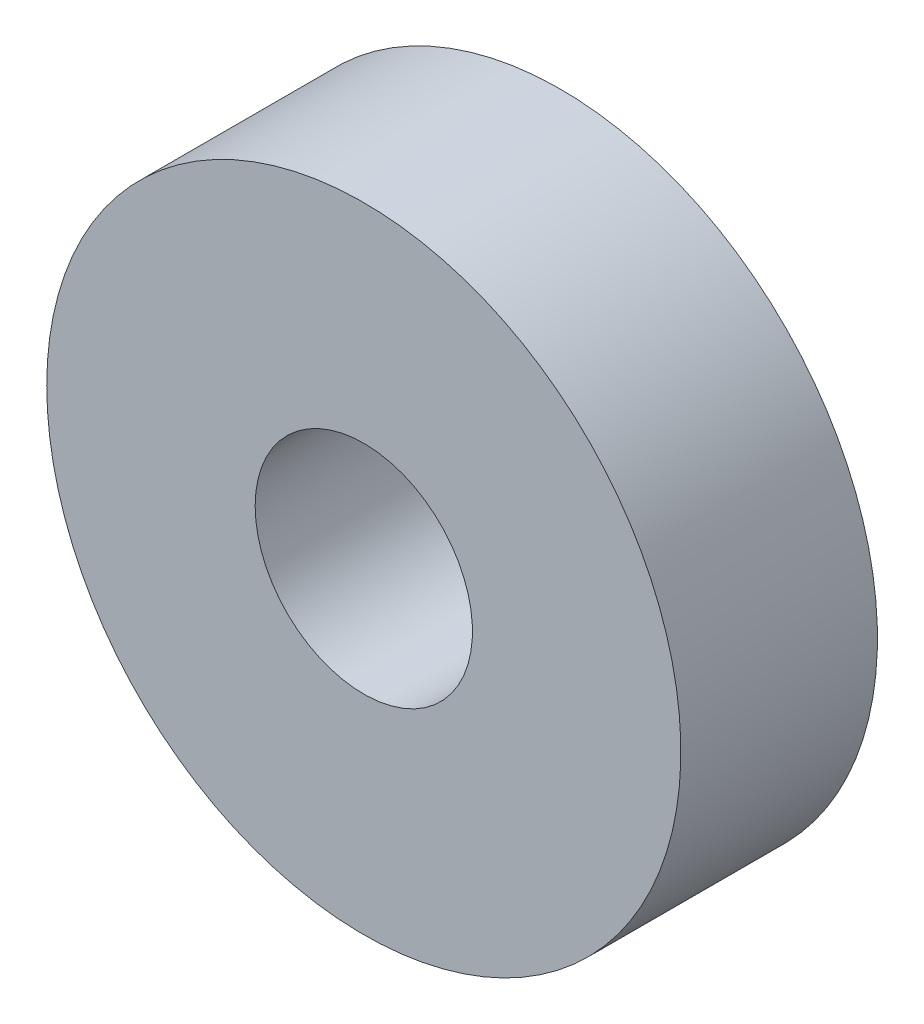
from build123d import *

# Parameters (mm, degrees)
SKETCH1_W = 5.9055
SKETCH1_H = 6.2611


with BuildPart() as part:
    # Sketch1 → Revolve1 (revolve)
    with BuildSketch(Plane(origin=(0, 0, 0), x_dir=(0, 0, -1), z_dir=(1, 0, 0)), mode=Mode.PRIVATE) as revolve1_sk:
        with Locations((0, 6.39445)):
            Rectangle(SKETCH1_W, SKETCH1_H)
    revolve(revolve1_sk.sketch.rotate(Axis((0, 0, -21.730881676), (0, 0, 1)), 90), axis=Axis((0, 0, -21.730881676), (0, 0, 1)))


solid = part.part
